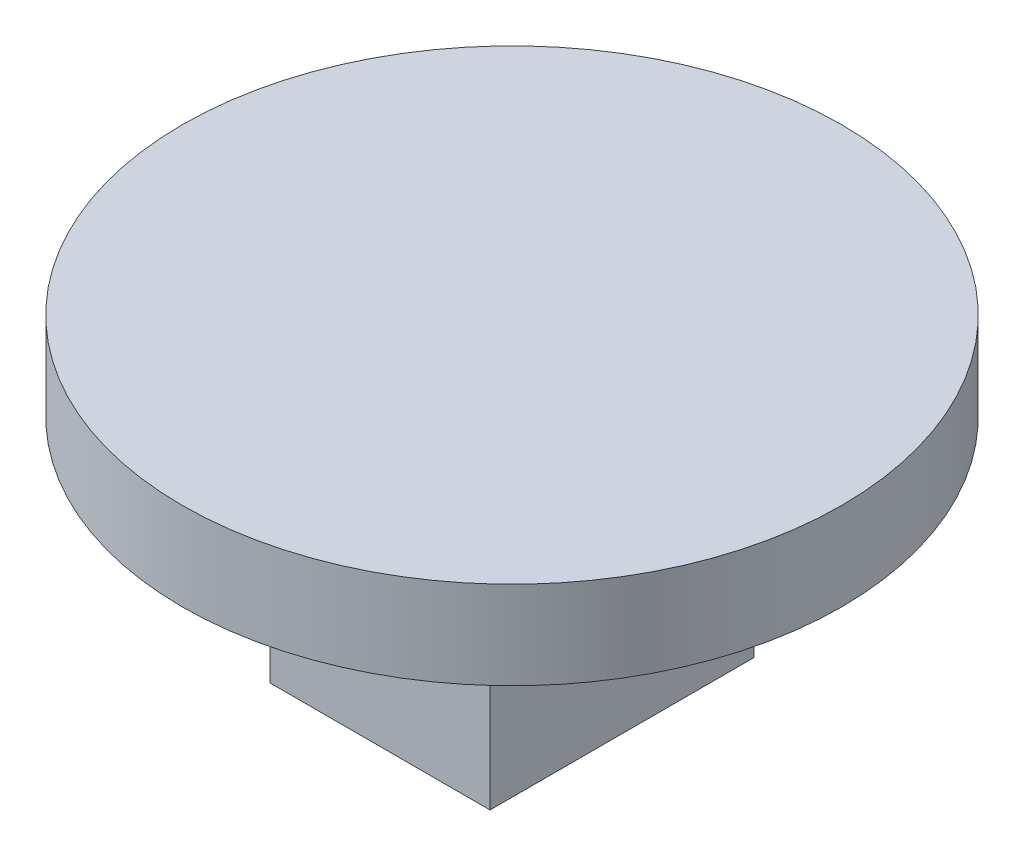
from build123d import *

# Parameters (mm, degrees)
SKETCH1_W           = 5
SKETCH1_H           = 6
BOSS_EXTRUDE1_DEPTH = 5
SKETCH2_W           = 3.25
SKETCH2_H           = 4.25
CUT_EXTRUDE1_DEPTH  = 5
SKETCH3_R           = 7.5
BOSS_EXTRUDE2_DEPTH = 2


with BuildPart() as part:
    # Sketch1 → Boss-Extrude1 (new body)
    with BuildSketch(Plane(origin=(0, 0, 0), x_dir=(1, 0, 0), z_dir=(0, 1, 0))):
        with Locations((2.5, 3)):
            Rectangle(SKETCH1_W, SKETCH1_H)
    extrude(amount=BOSS_EXTRUDE1_DEPTH)

    # Sketch2 → Cut-Extrude1 (cut)
    with BuildSketch(Plane.XZ):
        with Locations((2.5, -3)):
            Rectangle(SKETCH2_W, SKETCH2_H)
    extrude(amount=-CUT_EXTRUDE1_DEPTH, mode=Mode.SUBTRACT)

    # Sketch3 → Boss-Extrude2 (add)
    with BuildSketch(Plane(origin=(0, 5, 0), x_dir=(1, 0, 0), z_dir=(0, 1, 0))):
        with Locations(Location((2.5, 3, 0), (0, 0, 270))):
            Circle(SKETCH3_R)
    extrude(amount=BOSS_EXTRUDE2_DEPTH)


solid = part.part
